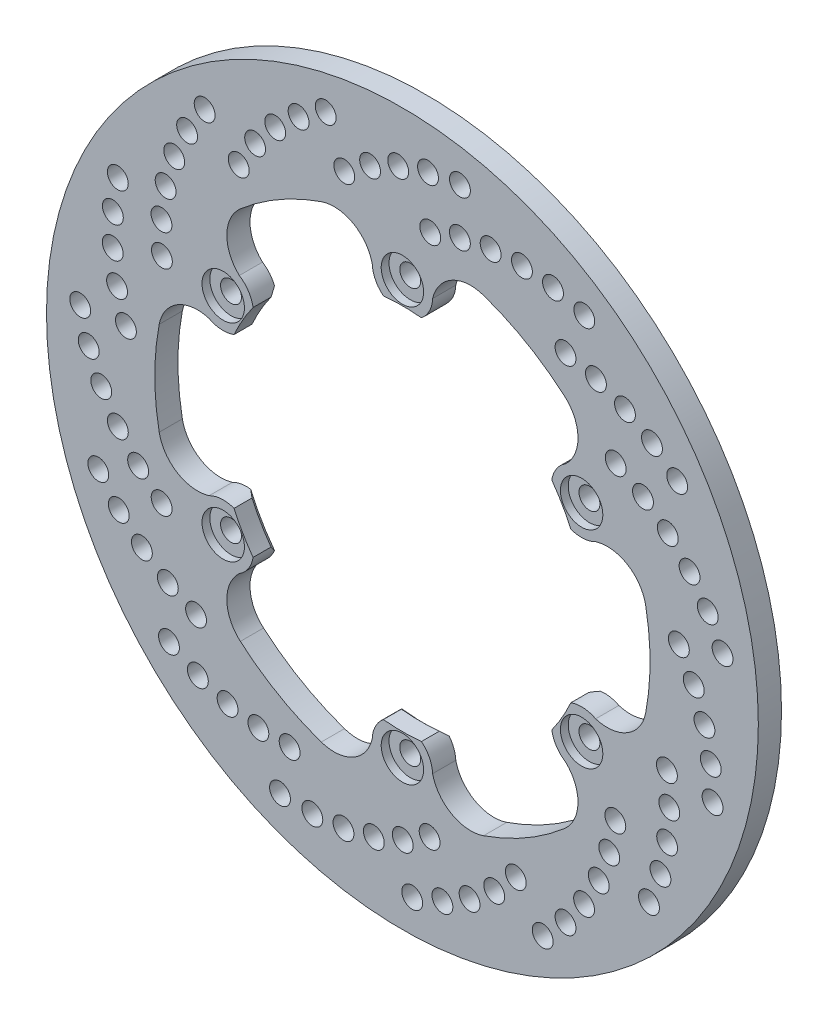
from build123d import *

# Parameters (mm, degrees)
SKETCH1_R                                          = 136.525
SKETCH1_R_2                                        = 70.745
BOSS_EXTRUDE1_DEPTH                                = 8.89
CBORE_FOR_5_16_PAN_HEAD_MACHINE_SCREW1_D           = 8.0264
CBORE_FOR_5_16_PAN_HEAD_MACHINE_SCREW1_CBORE_D     = 16.27124
CBORE_FOR_5_16_PAN_HEAD_MACHINE_SCREW1_CBORE_DEPTH = 2.9972
CIRPATTERN1_COUNT                                  = 6
CHAMFER1_SIZE                                      = 2
CUT_EXTRUDE1_DEPTH                                 = 194.280064544
SKETCH5_R                                          = 4
CUT_EXTRUDE4_DEPTH                                 = 194.280064548


with BuildPart() as part:
    # Sketch1 → Boss-Extrude1 (new body)
    with BuildSketch(Plane.XY):
        Circle(SKETCH1_R)
        Circle(SKETCH1_R_2, mode=Mode.SUBTRACT)
    extrude(amount=BOSS_EXTRUDE1_DEPTH)

    # CBORE for 5/16 Pan Head Machine Screw1 (through all)
    with Locations(Plane.XY.offset(8.89)):
        with Locations((0, 79.375)):
            cbore_for_5_16_pan_head_machine_screw1 = CounterBoreHole(CBORE_FOR_5_16_PAN_HEAD_MACHINE_SCREW1_D / 2, CBORE_FOR_5_16_PAN_HEAD_MACHINE_SCREW1_CBORE_D / 2, CBORE_FOR_5_16_PAN_HEAD_MACHINE_SCREW1_CBORE_DEPTH)

    # CirPattern1: CBORE for 5/16 Pan Head Machine Screw1 ×6 about axis
    cirpattern1_axis = Axis((0, 0, 0), (0, 0, 1))
    for i in range(1, CIRPATTERN1_COUNT):
        add(cbore_for_5_16_pan_head_machine_screw1.rotate(cirpattern1_axis, i * 360 / CIRPATTERN1_COUNT), mode=Mode.SUBTRACT)

    # Chamfer1
    chamfer1_edges = [part.edges().sort_by_distance(p)[0] for p in [
        (-70.745, 0, 0),
    ]]
    chamfer(chamfer1_edges, length=CHAMFER1_SIZE)

    # Sketch4 → Cut-Extrude1 (cut, through all)
    with BuildSketch(Plane.XY.offset(8.89)):
        with BuildLine():
            ThreePointArc((-31.127106776, 89.755797717), (-47.5, 82.27241336), (-62.167247572, 71.834764072))
            ThreePointArc((-62.167247572, 71.834764072), (-67.349164259, 60.749451719), (-62.550119076, 49.493094588))
            ThreePointArc((-62.550119076, 49.493094588), (-59.057749574, 46.068172729), (-57.28826567, 41.507946727))
            ThreePointArc((-57.28826567, 41.507946727), (-61.266967191, 35.3725), (-64.59106916, 28.859120046))
            ThreePointArc((-64.59106916, 28.859120046), (-69.425082677, 28.111425057), (-74.137336763, 29.423444836))
            ThreePointArc((-74.137336763, 29.423444836), (-86.285150584, 27.951361312), (-93.294354347, 17.921033644))
            ThreePointArc((-93.294354347, 17.921033644), (-95, 0), (-93.294354347, -17.921033644))
            ThreePointArc((-93.294354347, -17.921033644), (-86.285150584, -27.951361312), (-74.137336763, -29.423444836))
            ThreePointArc((-74.137336763, -29.423444836), (-69.425082677, -28.111425057), (-64.59106916, -28.859120046))
            ThreePointArc((-64.59106916, -28.859120046), (-61.266967191, -35.3725), (-57.28826567, -41.507946727))
            ThreePointArc((-57.28826567, -41.507946727), (-59.057749574, -46.068172729), (-62.550119076, -49.493094588))
            ThreePointArc((-62.550119076, -49.493094588), (-67.349164259, -60.749451719), (-62.167247572, -71.834764072))
            ThreePointArc((-62.167247572, -71.834764072), (-47.5, -82.27241336), (-31.127106776, -89.755797717))
            ThreePointArc((-31.127106776, -89.755797717), (-18.935986325, -88.700813031), (-11.587217687, -78.916539424))
            ThreePointArc((-11.587217687, -78.916539424), (-10.367333103, -74.179597786), (-7.302803489, -70.367066773))
            ThreePointArc((-7.302803489, -70.367066773), (0, -70.745), (7.302803489, -70.367066773))
            ThreePointArc((7.302803489, -70.367066773), (10.367333103, -74.179597786), (11.587217687, -78.916539424))
            ThreePointArc((11.587217687, -78.916539424), (18.935986325, -88.700813031), (31.127106776, -89.755797717))
            ThreePointArc((31.127106776, -89.755797717), (47.5, -82.27241336), (62.167247572, -71.834764072))
            ThreePointArc((62.167247572, -71.834764072), (67.349164259, -60.749451719), (62.550119076, -49.493094588))
            ThreePointArc((62.550119076, -49.493094588), (59.057749574, -46.068172729), (57.28826567, -41.507946727))
            ThreePointArc((57.28826567, -41.507946727), (61.266967191, -35.3725), (64.59106916, -28.859120046))
            ThreePointArc((64.59106916, -28.859120046), (69.425082677, -28.111425057), (74.137336763, -29.423444836))
            ThreePointArc((74.137336763, -29.423444836), (86.285150584, -27.951361312), (93.294354347, -17.921033644))
            ThreePointArc((93.294354347, -17.921033644), (95, 0), (93.294354347, 17.921033644))
            ThreePointArc((93.294354347, 17.921033644), (86.285150584, 27.951361312), (74.137336763, 29.423444836))
            ThreePointArc((74.137336763, 29.423444836), (69.425082677, 28.111425057), (64.59106916, 28.859120046))
            ThreePointArc((64.59106916, 28.859120046), (61.266967191, 35.3725), (57.28826567, 41.507946727))
            ThreePointArc((57.28826567, 41.507946727), (59.057749574, 46.068172729), (62.550119076, 49.493094588))
            ThreePointArc((62.550119076, 49.493094588), (67.349164259, 60.749451719), (62.167247572, 71.834764072))
            ThreePointArc((62.167247572, 71.834764072), (47.5, 82.27241336), (31.127106776, 89.755797717))
            ThreePointArc((31.127106776, 89.755797717), (18.935986325, 88.700813031), (11.587217687, 78.916539424))
            ThreePointArc((11.587217687, 78.916539424), (10.367333103, 74.179597786), (7.302803489, 70.367066773))
            ThreePointArc((7.302803489, 70.367066773), (0, 70.745), (-7.302803489, 70.367066773))
            ThreePointArc((-7.302803489, 70.367066773), (-10.367333103, 74.179597786), (-11.587217687, 78.916539424))
            ThreePointArc((-11.587217687, 78.916539424), (-18.935986325, 88.700813031), (-31.127106776, 89.755797717))
        make_face()
    extrude(amount=-CUT_EXTRUDE1_DEPTH, mode=Mode.SUBTRACT)

    # Sketch5 → Cut-Extrude4 (cut, through all)
    with BuildSketch(Plane.XY.offset(8.89)):
        with Locations((10.680221356, 100.471094204)):
            Circle(SKETCH5_R)
        with Locations((22.042561371, 104.330787118)):
            Circle(SKETCH5_R)
        with Locations((33.8454204, 106.497009341)):
            Circle(SKETCH5_R)
        with Locations((45.83783196, 106.92370007)):
            Circle(SKETCH5_R)
        with Locations((57.764799073, 105.601786496)):
            Circle(SKETCH5_R)
        with Locations((69.764799073, 102.4242782)):
            Circle(SKETCH5_R)
        with Locations((62.572035937, 86.345399247)):
            Circle(SKETCH5_R)
        with Locations((74.235566146, 83.523686459)):
            Circle(SKETCH5_R)
        with Locations((85.364730007, 79.035734616)):
            Circle(SKETCH5_R)
        with Locations((95.722885947, 72.97697191)):
            Circle(SKETCH5_R)
        with Locations((105.393022381, 65.193333922)):
            Circle(SKETCH5_R)
        with Locations((92.28223704, 53.430107423)):
            Circle(SKETCH5_R)
        with Locations((101.789708096, 46.108359399)):
            Circle(SKETCH5_R)
        with Locations((110.131290722, 37.48177263)):
            Circle(SKETCH5_R)
        with Locations((117.129616226, 27.733775905)):
            Circle(SKETCH5_R)
        with Locations((122.797834654, 16.689869946)):
            Circle(SKETCH5_R)
        with Locations((106.036001002, 11.276264629)):
            Circle(SKETCH5_R)
        with Locations((111.743484786, 0.720478118)):
            Circle(SKETCH5_R)
        with Locations((115.855150759, -10.553128356)):
            Circle(SKETCH5_R)
        with Locations((118.28357177, -22.304841907)):
            Circle(SKETCH5_R)
        with Locations((118.969785732, -34.699424166)):
            Circle(SKETCH5_R)
        with Locations((101.455177083, -32.827346762)):
            Circle(SKETCH5_R)
        with Locations((102.375797798, -44.791980375)):
            Circle(SKETCH5_R)
        with Locations((101.546602719, -56.763297576)):
            Circle(SKETCH5_R)
        with Locations((98.985223182, -68.48674992)):
            Circle(SKETCH5_R)
        with Locations((94.57078005, -80.088872605)):
            Circle(SKETCH5_R)
        with Locations((79.331831356, -71.25481167)):
            Circle(SKETCH5_R)
        with Locations((75.306405317, -82.559498539)):
            Circle(SKETCH5_R)
        with Locations((69.679724547, -93.158576967)):
            Circle(SKETCH5_R)
        with Locations((62.571430254, -102.82667669)):
            Circle(SKETCH5_R)
        with Locations((53.819627349, -111.630227387)):
            Circle(SKETCH5_R)
        with Locations((43.49129128, -97.361672311)):
            Circle(SKETCH5_R)
        with Locations((35.215851218, -106.051729376)):
            Circle(SKETCH5_R)
        with Locations((25.764588981, -113.445892081)):
            Circle(SKETCH5_R)
        with Locations((15.338468592, -119.386936908)):
            Circle(SKETCH5_R)
        with Locations((3.762572144, -123.869701725)):
            Circle(SKETCH5_R)
        with Locations((0.130711835, -106.633815307)):
            Circle(SKETCH5_R)
        with Locations((-10.963843481, -111.206652755)):
            Circle(SKETCH5_R)
        with Locations((-22.605478085, -114.117381831)):
            Circle(SKETCH5_R)
        with Locations((-34.546653636, -115.304111139)):
            Circle(SKETCH5_R)
        with Locations((-46.945065967, -114.690979313)):
            Circle(SKETCH5_R)
        with Locations((-43.252468873, -97.468002898)):
            Circle(SKETCH5_R)
        with Locations((-55.24779004, -97.132935591)):
            Circle(SKETCH5_R)
        with Locations((-67.066852625, -95.056939539)):
            Circle(SKETCH5_R)
        with Locations((-78.458345604, -91.284157049)):
            Circle(SKETCH5_R)
        with Locations((-89.53547569, -85.681144643)):
            Circle(SKETCH5_R)
        with Locations((-79.156904776, -71.449087319)):
            Circle(SKETCH5_R)
        with Locations((-89.97889179, -66.264051438)):
            Circle(SKETCH5_R)
        with Locations((-99.931759063, -59.560288835)):
            Circle(SKETCH5_R)
        with Locations((-108.803876845, -51.480342915)):
            Circle(SKETCH5_R)
        with Locations((-116.644388262, -41.856261676)):
            Circle(SKETCH5_R)
        with Locations((-101.374392726, -33.075975448)):
            Circle(SKETCH5_R)
        with Locations((-109.151825717, -23.937510802)):
            Circle(SKETCH5_R)
        with Locations((-115.517556507, -13.765123103)):
            Circle(SKETCH5_R)
        with Locations((-120.336229327, -2.775109807)):
            Circle(SKETCH5_R)
        with Locations((-123.584426422, 9.205949187)):
            Circle(SKETCH5_R)
        with Locations((-106.063327216, 11.016273064)):
            Circle(SKETCH5_R)
        with Locations((-109.451417364, 22.528042917)):
            Circle(SKETCH5_R)
        with Locations((-111.129318988, 34.410157466)):
            Circle(SKETCH5_R)
        with Locations((-111.061354538, 46.409964999)):
            Circle(SKETCH5_R)
        with Locations((-109.155594524, 58.676367802)):
            Circle(SKETCH5_R)
        with Locations((-92.412948876, 53.203707883)):
            Circle(SKETCH5_R)
        with Locations((-90.825864615, 65.098293355)):
            Circle(SKETCH5_R)
        with Locations((-87.525812637, 76.635609202)):
            Circle(SKETCH5_R)
        with Locations((-82.582962589, 87.570335234)):
            Circle(SKETCH5_R)
        with Locations((-75.852768686, 98.001109367)):
            Circle(SKETCH5_R)
        with Locations((-62.783532129, 86.191738269)):
            Circle(SKETCH5_R)
        with Locations((-56.495694746, 96.412457473)):
            Circle(SKETCH5_R)
        with Locations((-48.788298134, 105.610067894)):
            Circle(SKETCH5_R)
        with Locations((-39.825226166, 113.588998956)):
            Circle(SKETCH5_R)
        with Locations((-29.434310041, 120.380568809)):
            Circle(SKETCH5_R)
        with Locations((-22.298272307, 104.276434081)):
            Circle(SKETCH5_R)
        with Locations((-12.396906008, 111.056031814)):
            Circle(SKETCH5_R)
        with Locations((-1.614843656, 116.323586411)):
            Circle(SKETCH5_R)
        with Locations((9.818653662, 119.967092835)):
            Circle(SKETCH5_R)
        with Locations((22.073608212, 121.945134282)):
            Circle(SKETCH5_R)
        with Locations((81.81103676, 59.291332951)):
            Circle(SKETCH5_R)
        with Locations((81.670409249, -59.484890114)):
            Circle(SKETCH5_R)
        with Locations((10.44228218, -100.496102619)):
            Circle(SKETCH5_R)
        with Locations((-92.350630605, -40.98620409)):
            Circle(SKETCH5_R)
        with Locations((-92.253318939, 41.204769668)):
            Circle(SKETCH5_R)
    extrude(amount=-CUT_EXTRUDE4_DEPTH, mode=Mode.SUBTRACT)


solid = part.part
